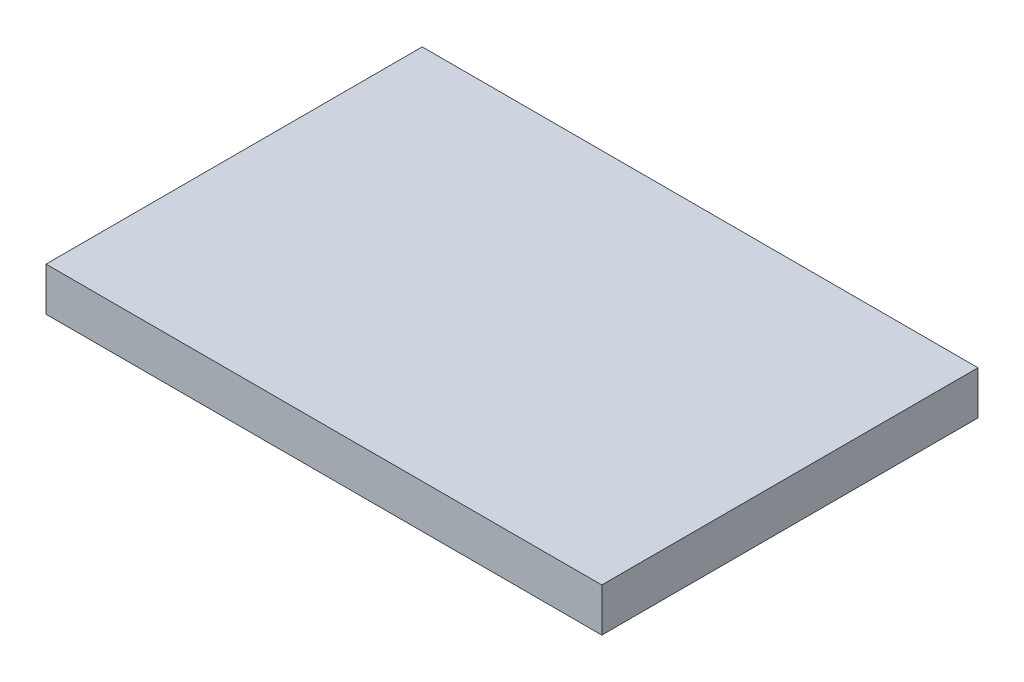
from build123d import *

# Parameters (mm, degrees)
SKETCH3_W           = 325
SKETCH3_H           = 220
BOSS_EXTRUDE1_DEPTH = 25.4


with BuildPart() as part:
    # Sketch3 → Boss-Extrude1 (new body)
    with BuildSketch(Plane(origin=(0, 0, 0), x_dir=(1, 0, 0), z_dir=(0, 1, 0))):
        with Locations((162.5, 110)):
            Rectangle(SKETCH3_W, SKETCH3_H)
    extrude(amount=BOSS_EXTRUDE1_DEPTH)


solid = part.part
